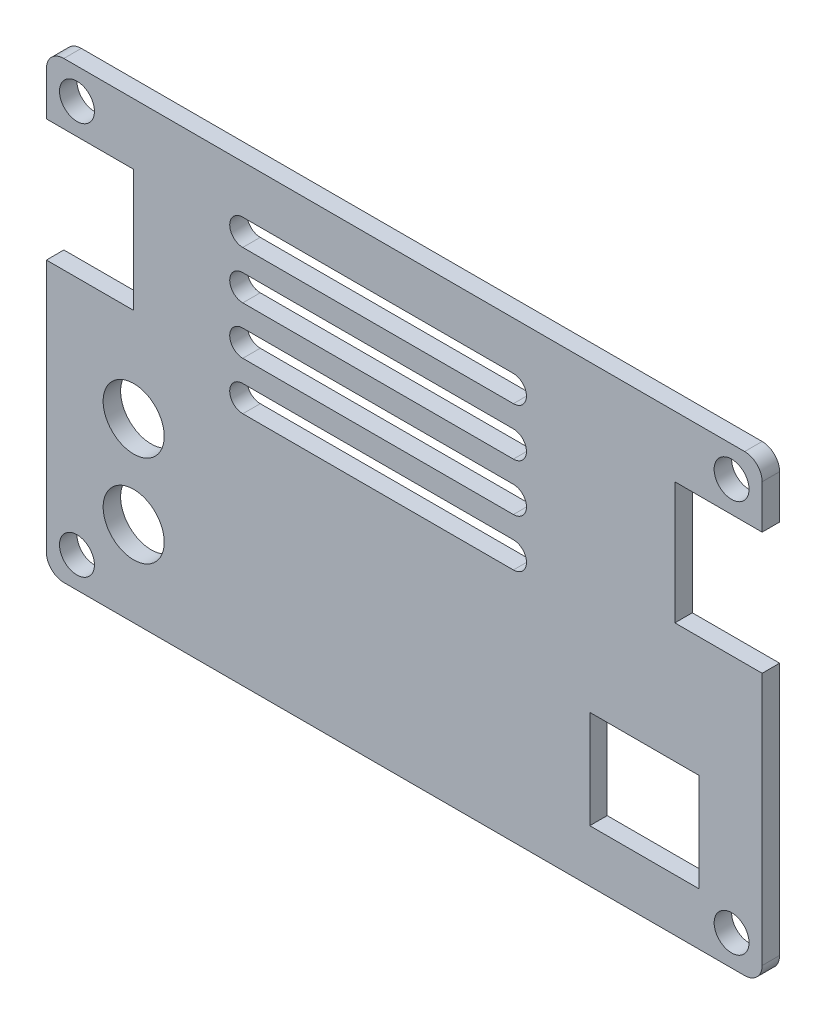
from build123d import *

# Parameters (mm, degrees)
SKETCH1_W           = 82
SKETCH1_H           = 52
BOSS_EXTRUDE1_DEPTH = 2
FILLET1_R           = 2
CUT_EXTRUDE1_DEPTH  = 49.590122453
SKETCH3_R           = 2
CUT_EXTRUDE2_DEPTH  = 49.590122453
SKETCH4_R           = 3.5
SKETCH4_W           = 10
SKETCH4_H           = 14
SKETCH4_W_2         = 12.5
SKETCH4_H_2         = 11.25
CUT_EXTRUDE3_DEPTH  = 49.590122453


with BuildPart() as part:
    # Sketch1 → Boss-Extrude1 (new body)
    with BuildSketch(Plane.XY):
        Rectangle(SKETCH1_W, SKETCH1_H)
    extrude(amount=BOSS_EXTRUDE1_DEPTH)

    # Fillet1
    fillet1_edges = [part.edges().sort_by_distance(p)[0] for p in [
        (-41, 26, 1),
        (41, 26, 1),
        (41, -26, 1),
        (-41, -26, 1),
    ]]
    fillet(fillet1_edges, radius=FILLET1_R)

    # Sketch2 → Cut-Extrude1 (cut, through all)
    with BuildSketch(Plane.XY.offset(2)):
        with BuildLine():
            Line((-18.5, 20.5), (12.5, 20.5))
            ThreePointArc((12.5, 20.5), (14, 19), (12.5, 17.5))
            Line((12.5, 17.5), (-18.5, 17.5))
            ThreePointArc((-18.5, 17.5), (-20, 19), (-18.5, 20.5))
        make_face()
        with BuildLine():
            Line((-18.5, 15), (12.5, 15))
            ThreePointArc((12.5, 15), (14, 13.5), (12.5, 12))
            Line((12.5, 12), (-18.5, 12))
            ThreePointArc((-18.5, 12), (-20, 13.5), (-18.5, 15))
        make_face()
        with BuildLine():
            Line((-18.5, 9.5), (12.5, 9.5))
            ThreePointArc((12.5, 9.5), (14, 8), (12.5, 6.5))
            Line((12.5, 6.5), (-18.5, 6.5))
            ThreePointArc((-18.5, 6.5), (-20, 8), (-18.5, 9.5))
        make_face()
        with BuildLine():
            Line((-18.5, 4), (12.5, 4))
            ThreePointArc((12.5, 4), (14, 2.5), (12.5, 1))
            Line((12.5, 1), (-18.5, 1))
            ThreePointArc((-18.5, 1), (-20, 2.5), (-18.5, 4))
        make_face()
    extrude(amount=-CUT_EXTRUDE1_DEPTH, mode=Mode.SUBTRACT)

    # Sketch3 → Cut-Extrude2 (cut, through all)
    with BuildSketch(Plane.XY.offset(2)):
        with Locations((37.5, 22.5)):
            Circle(SKETCH3_R)
        with Locations((-37.5, 22.5)):
            Circle(SKETCH3_R)
        with Locations((37.5, -22.5)):
            Circle(SKETCH3_R)
        with Locations((-37.5, -22.5)):
            Circle(SKETCH3_R)
    extrude(amount=-CUT_EXTRUDE2_DEPTH, mode=Mode.SUBTRACT)

    # Sketch4 → Cut-Extrude3 (cut, through all)
    with BuildSketch(Plane.XY.offset(2)):
        with Locations((-31, -5.75)):
            Circle(SKETCH4_R)
        with Locations((-31, -16.25)):
            Circle(SKETCH4_R)
        with Locations((-36, 12)):
            Rectangle(SKETCH4_W, SKETCH4_H)
        with Locations((36, 12)):
            Rectangle(SKETCH4_W, SKETCH4_H)
        with Locations((27.5, -14.375)):
            Rectangle(SKETCH4_W_2, SKETCH4_H_2)
    extrude(amount=-CUT_EXTRUDE3_DEPTH, mode=Mode.SUBTRACT)


solid = part.part
